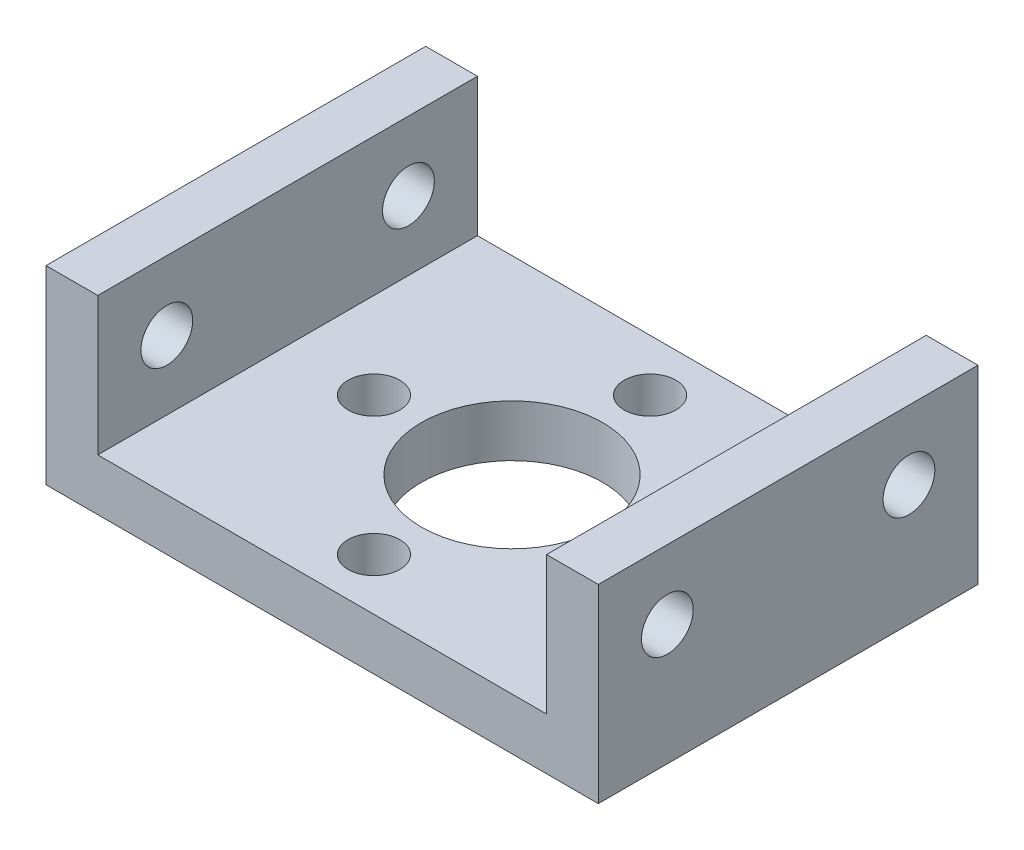
from build123d import *

# Parameters (mm, degrees)
SKETCH_1_W          = 32
SKETCH_1_H          = 22
EXTRUDE_1_DEPTH     = 3
SKETCH_2_W          = 3
SKETCH_2_H          = 22
EXTRUDE_2_DEPTH     = 8
SKETCH_3_R          = 1.5
CUT_EXTRUDE_1_DEPTH = 36.580893749
SKETCH_4_R          = 5.25
SKETCH_4_R_2        = 1.5
CUT_EXTRUDE_2_DEPTH = 22


with BuildPart() as part:
    # 草图1 → 凸台-拉伸1 (new body)
    with BuildSketch(Plane(origin=(0, 0, 0), x_dir=(1, 0, 0), z_dir=(0, 1, 0))):
        Rectangle(SKETCH_1_W, SKETCH_1_H)
    extrude(amount=EXTRUDE_1_DEPTH)

    # 草图2 → 凸台-拉伸2 (add)
    with BuildSketch(Plane(origin=(0, 3, 0), x_dir=(1, 0, 0), z_dir=(0, 1, 0))):
        with Locations((-14.5, 0)):
            Rectangle(SKETCH_2_W, SKETCH_2_H)
        with Locations((14.5, 0)):
            Rectangle(SKETCH_2_W, SKETCH_2_H)
    extrude(amount=EXTRUDE_2_DEPTH)

    # 草图3 → 切除-拉伸1 (cut, through all)
    with BuildSketch(Plane(origin=(16, 0, 0), x_dir=(0, 0, -1), z_dir=(1, 0, 0))):
        with Locations((-7, 7)):
            Circle(SKETCH_3_R)
        with Locations((7, 7)):
            Circle(SKETCH_3_R)
    extrude(amount=-CUT_EXTRUDE_1_DEPTH, mode=Mode.SUBTRACT)

    # 草图4 → 切除-拉伸2 (cut, through all)
    with BuildSketch(Plane(origin=(0, 3, 0), x_dir=(1, 0, 0), z_dir=(0, 1, 0))):
        with Locations(Location((0, 0, 0), (0, 0, 270))):
            Circle(SKETCH_4_R)
        with Locations(Location((0, 8, 0), (0, 0, 270))):
            Circle(SKETCH_4_R_2)
        with Locations(Location((8, 0, 0), (0, 0, 270))):
            Circle(SKETCH_4_R_2)
        with Locations(Location((0, -8, 0), (0, 0, 270))):
            Circle(SKETCH_4_R_2)
        with Locations(Location((-8, 0, 0), (0, 0, 270))):
            Circle(SKETCH_4_R_2)
    extrude(amount=-CUT_EXTRUDE_2_DEPTH, mode=Mode.SUBTRACT)


solid = part.part
